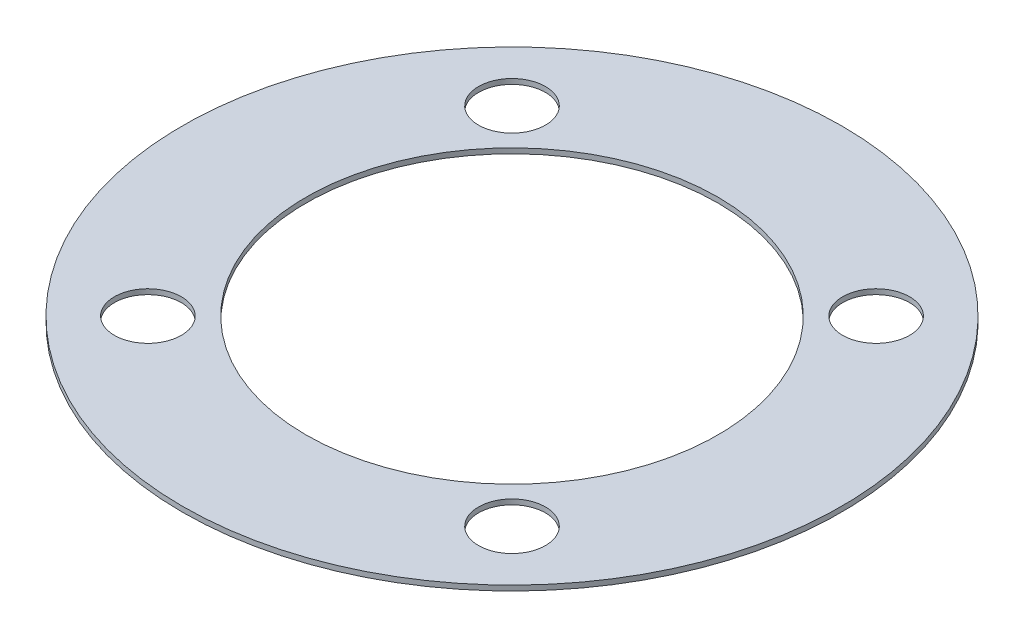
from build123d import *

# Parameters (mm, degrees)
SKETCH1_R           = 32
SKETCH1_R_2         = 20
SKETCH1_R_3         = 3.25
BOSS_EXTRUDE1_DEPTH = 0.5


with BuildPart() as part:
    # Sketch1 → Boss-Extrude1 (new body)
    with BuildSketch(Plane(origin=(0, 0, 0), x_dir=(1, 0, 0), z_dir=(0, 1, 0))):
        with Locations(Location((0, 0, 0), (0, 0, 270))):
            Circle(SKETCH1_R)
        with Locations(Location((0, 0, 0), (0, 0, 270))):
            Circle(SKETCH1_R_2, mode=Mode.SUBTRACT)
        with Locations(Location((-17.67766953, 17.67766953, 0), (0, 0, 270))):
            Circle(SKETCH1_R_3, mode=Mode.SUBTRACT)
        with Locations(Location((17.67766953, 17.67766953, 0), (0, 0, 270))):
            Circle(SKETCH1_R_3, mode=Mode.SUBTRACT)
        with Locations(Location((17.67766953, -17.67766953, 0), (0, 0, 270))):
            Circle(SKETCH1_R_3, mode=Mode.SUBTRACT)
        with Locations(Location((-17.67766953, -17.67766953, 0), (0, 0, 270))):
            Circle(SKETCH1_R_3, mode=Mode.SUBTRACT)
    extrude(amount=BOSS_EXTRUDE1_DEPTH)


solid = part.part
